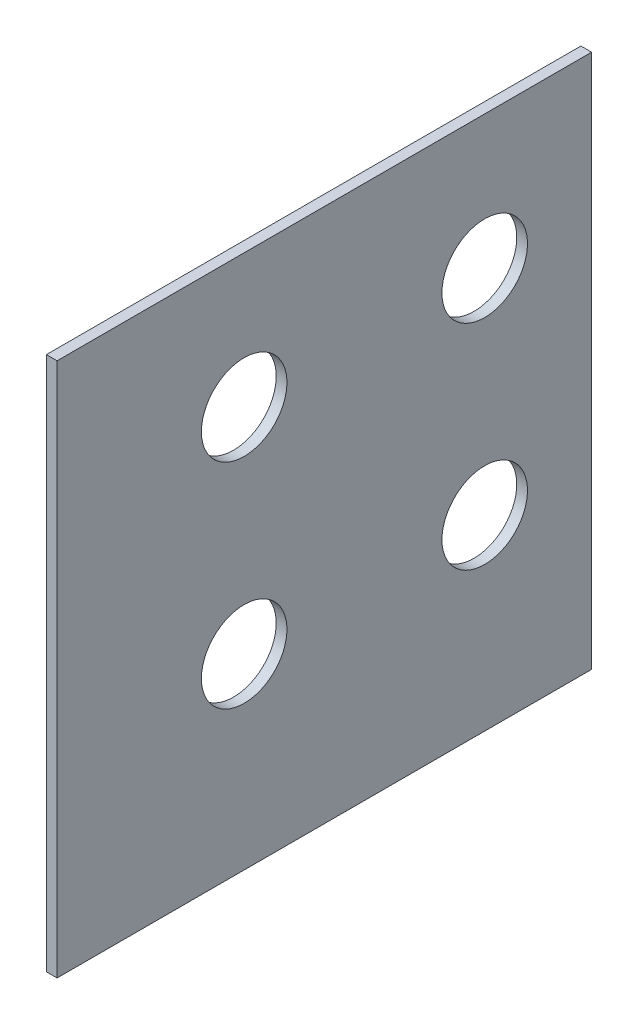
from build123d import *

# Parameters (mm, degrees)
SKETCH1_W           = 20
SKETCH1_H           = 20
BOSS_EXTRUDE1_DEPTH = 0.4
SKETCH2_R           = 1.6
CUT_EXTRUDE1_DEPTH  = 0.4


with BuildPart() as part:
    # Sketch1 → Boss-Extrude1 (new body)
    with BuildSketch(Plane(origin=(0, 0, 0), x_dir=(0, 0, -1), z_dir=(1, 0, 0))):
        with Locations((-132.306860457, -13.392602836)):
            Rectangle(SKETCH1_W, SKETCH1_H)
    extrude(amount=BOSS_EXTRUDE1_DEPTH)

    # Sketch2 → Cut-Extrude1 (cut)
    with BuildSketch(Plane.ZY):
        with Locations((126.306860457, -8.392602836)):
            Circle(SKETCH2_R)
        with Locations((126.306860457, -16.392602836)):
            Circle(SKETCH2_R)
        with Locations((135.306860457, -8.392602836)):
            Circle(SKETCH2_R)
        with Locations((135.306860457, -16.392602836)):
            Circle(SKETCH2_R)
    extrude(amount=-CUT_EXTRUDE1_DEPTH, mode=Mode.SUBTRACT)


solid = part.part
